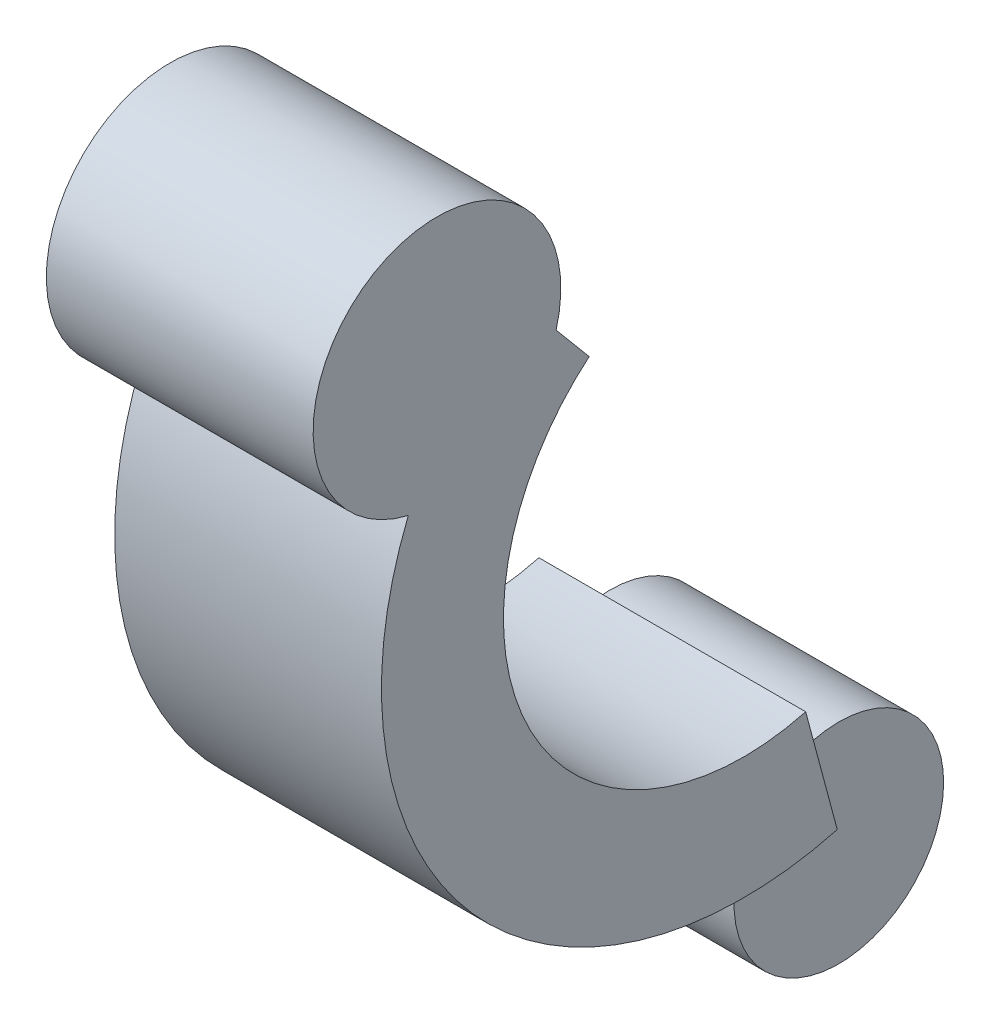
from build123d import *

# Parameters (mm, degrees)
GANCHO_TROCLEAR_DEPTH = 14
SKETCH2_R             = 6.5
OLECRANON_DEPTH       = 14
SKETCH3_R             = 5.5
CORONOIDES_DEPTH      = 12


with BuildPart() as part:
    # Sketch1 → Gancho_troclear (new body)
    with BuildSketch(Plane(origin=(-7, 0, 0), x_dir=(0, 0, -1), z_dir=(1, 0, 0))):
        with BuildLine():
            Line((4.917561857, -18.352590699), (3.261119968, -12.170665411))
            ThreePointArc((3.261119968, -12.170665411), (-11.176336498, -5.818032527), (-8.099123882, 9.652159983))
            Line((-8.099123882, 9.652159983), (-12.212964584, 14.554844419))
            ThreePointArc((-12.212964584, 14.554844419), (-16.85320583, -8.773223651), (4.917561857, -18.352590699))
        make_face()
    extrude(amount=GANCHO_TROCLEAR_DEPTH)

    # Sketch2 → Olecranon (add)
    with BuildSketch(Plane(origin=(-7, 0, 0), x_dir=(0, 0, -1), z_dir=(1, 0, 0))):
        with Locations((-16.086933305, 13.498539803)):
            Circle(SKETCH2_R)
    extrude(amount=OLECRANON_DEPTH)

    # Sketch3 → Coronoides (add)
    with BuildSketch(Plane(origin=(-6, 0, 0), x_dir=(0, 0, -1), z_dir=(1, 0, 0))):
        with Locations((6, -20)):
            Circle(SKETCH3_R)
    extrude(amount=CORONOIDES_DEPTH)


solid = part.part
